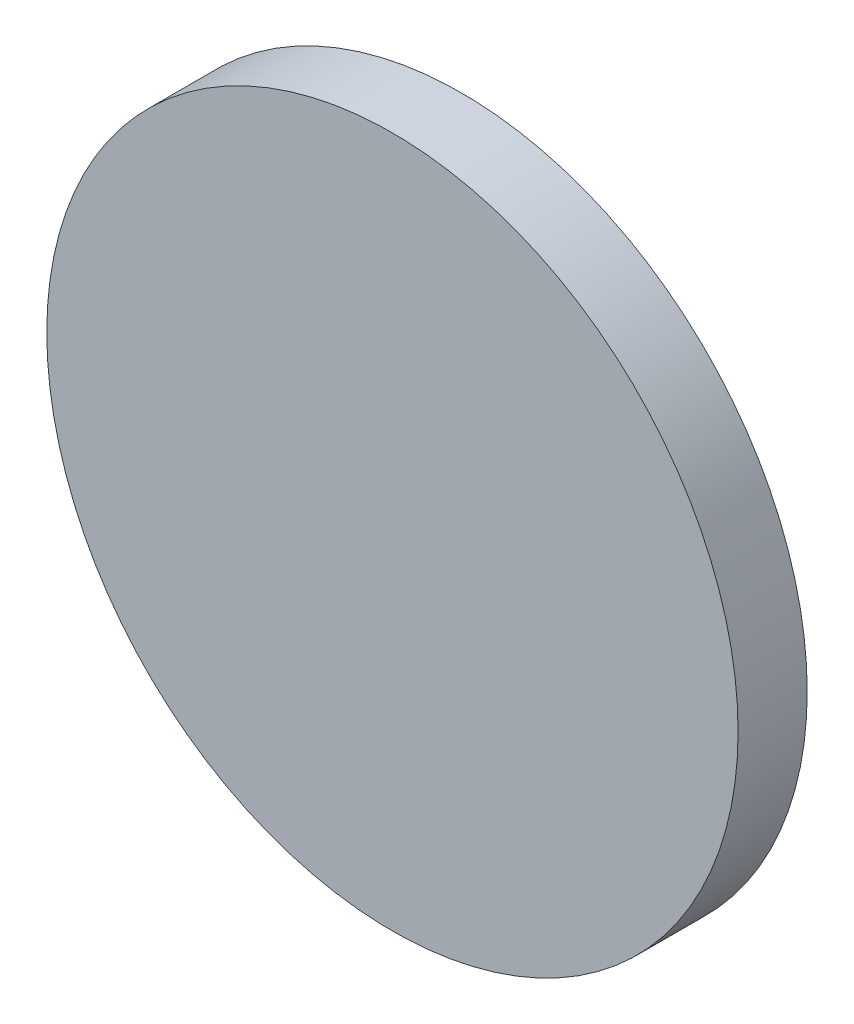
from build123d import *

# Parameters (mm, degrees)
SKETCH1_R           = 25.4
BOSS_EXTRUDE1_DEPTH = 5.08


with BuildPart() as part:
    # Sketch1 → Boss-Extrude1 (new body)
    with BuildSketch(Plane.XY):
        Circle(SKETCH1_R)
    extrude(amount=BOSS_EXTRUDE1_DEPTH)


solid = part.part
